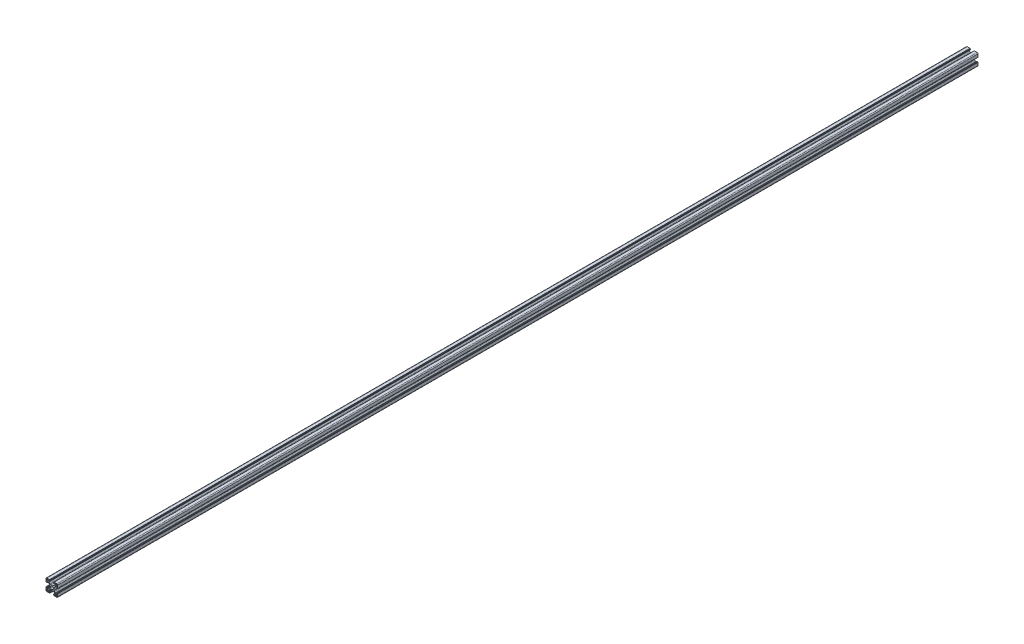
from build123d import *

# Parameters (mm, degrees)
EXTRUDE_1_DEPTH = 1570


with BuildPart() as part:
    # Эскиз1 → Бобышка-Вытянуть1 (new body)
    with BuildSketch(Plane.XY):
        with BuildLine():
            Line((0.259458272, 4.035699369), (2.158238941, 4.035699369))
            ThreePointArc((2.158238941, 4.035699369), (2.923605806, 4.187940304), (3.572452504, 4.621485807))
            Line((3.572452504, 4.621485807), (4.873671834, 5.922705138))
            ThreePointArc((4.873671834, 5.922705138), (5.307217337, 6.571551836), (5.459458272, 7.3369187))
            Line((5.459458272, 7.3369187), (5.459458272, 8.235699369))
            ThreePointArc((5.459458272, 8.235699369), (5.313011663, 8.58925276), (4.959458272, 8.735699369))
            Line((4.959458272, 8.735699369), (4.856565053, 8.735699369))
            ThreePointArc((4.856565053, 8.735699369), (4.665223337, 8.697639136), (4.503011663, 8.58925276))
            Line((4.503011663, 8.58925276), (4.022681577, 8.108922674))
            ThreePointArc((4.022681577, 8.108922674), (3.94157574, 8.054729486), (3.845904882, 8.035699369))
            Line((3.845904882, 8.035699369), (3.559458272, 8.035699369))
            ThreePointArc((3.559458272, 8.035699369), (3.382681577, 8.108922674), (3.309458272, 8.285699369))
            Line((3.309458272, 8.285699369), (3.309458272, 9.43477019))
            ThreePointArc((3.309458272, 9.43477019), (3.353392255, 9.540836207), (3.459458272, 9.58477019))
            Line((3.459458272, 9.58477019), (3.959458272, 9.58477019))
            Line((3.959458272, 9.58477019), (3.959458272, 9.885699369))
            ThreePointArc((3.959458272, 9.885699369), (4.003392255, 9.991765387), (4.109458272, 10.035699369))
            Line((4.109458272, 10.035699369), (8.759458272, 10.035699369))
            ThreePointArc((8.759458272, 10.035699369), (9.820118444, 9.596359541), (10.259458272, 8.535699369))
            Line((10.259458272, 8.535699369), (10.259458272, 3.885699369))
            ThreePointArc((10.259458272, 3.885699369), (10.215524289, 3.779633352), (10.109458272, 3.735699369))
            Line((10.109458272, 3.735699369), (9.808529093, 3.735699369))
            Line((9.808529093, 3.735699369), (9.808529093, 3.235699369))
            ThreePointArc((9.808529093, 3.235699369), (9.76459511, 3.129633352), (9.658529093, 3.085699369))
            Line((9.658529093, 3.085699369), (8.509458272, 3.085699369))
            ThreePointArc((8.509458272, 3.085699369), (8.332681577, 3.158922674), (8.259458272, 3.335699369))
            Line((8.259458272, 3.335699369), (8.259458272, 3.622145979))
            ThreePointArc((8.259458272, 3.622145979), (8.278488389, 3.717816837), (8.332681577, 3.798922674))
            Line((8.332681577, 3.798922674), (8.813011663, 4.27925276))
            ThreePointArc((8.813011663, 4.27925276), (8.921398038, 4.441464434), (8.959458272, 4.632806151))
            Line((8.959458272, 4.632806151), (8.959458272, 4.735699369))
            ThreePointArc((8.959458272, 4.735699369), (8.813011663, 5.08925276), (8.459458272, 5.235699369))
            Line((8.459458272, 5.235699369), (7.560677603, 5.235699369))
            ThreePointArc((7.560677603, 5.235699369), (6.795310738, 5.083458434), (6.146464041, 4.649912932))
            Line((6.146464041, 4.649912932), (4.84524471, 3.348693601))
            ThreePointArc((4.84524471, 3.348693601), (4.411699207, 2.699846903), (4.259458272, 1.934480039))
            Line((4.259458272, 1.934480039), (4.259458272, 0.035699369))
            Line((4.259458272, 0.035699369), (4.259458272, -1.8630813))
            ThreePointArc((4.259458272, -1.8630813), (4.411699207, -2.628448164), (4.84524471, -3.277294862))
            Line((4.84524471, -3.277294862), (6.146464041, -4.578514193))
            ThreePointArc((6.146464041, -4.578514193), (6.795310738, -5.012059696), (7.560677603, -5.164300631))
            Line((7.560677603, -5.164300631), (8.459458272, -5.164300631))
            ThreePointArc((8.459458272, -5.164300631), (8.813011663, -5.017854021), (8.959458272, -4.664300631))
            Line((8.959458272, -4.664300631), (8.959458272, -4.561407412))
            ThreePointArc((8.959458272, -4.561407412), (8.921398038, -4.370065696), (8.813011663, -4.207854021))
            Line((8.813011663, -4.207854021), (8.332681577, -3.727523935))
            ThreePointArc((8.332681577, -3.727523935), (8.278488389, -3.646418098), (8.259458272, -3.55074724))
            Line((8.259458272, -3.55074724), (8.259458272, -3.264300631))
            ThreePointArc((8.259458272, -3.264300631), (8.332681577, -3.087523935), (8.509458272, -3.014300631))
            Line((8.509458272, -3.014300631), (9.658529093, -3.014300631))
            ThreePointArc((9.658529093, -3.014300631), (9.76459511, -3.058234613), (9.808529093, -3.164300631))
            Line((9.808529093, -3.164300631), (9.808529093, -3.664300631))
            Line((9.808529093, -3.664300631), (10.109458272, -3.664300631))
            ThreePointArc((10.109458272, -3.664300631), (10.215524289, -3.708234613), (10.259458272, -3.814300631))
            Line((10.259458272, -3.814300631), (10.259458272, -8.464300631))
            ThreePointArc((10.259458272, -8.464300631), (9.820118444, -9.524960802), (8.759458272, -9.964300631))
            Line((8.759458272, -9.964300631), (4.109458272, -9.964300631))
            ThreePointArc((4.109458272, -9.964300631), (4.003392255, -9.920366648), (3.959458272, -9.814300631))
            Line((3.959458272, -9.814300631), (3.959458272, -9.513371451))
            Line((3.959458272, -9.513371451), (3.459458272, -9.513371451))
            ThreePointArc((3.459458272, -9.513371451), (3.353392255, -9.469437468), (3.309458272, -9.363371451))
            Line((3.309458272, -9.363371451), (3.309458272, -8.214300631))
            ThreePointArc((3.309458272, -8.214300631), (3.382681577, -8.037523935), (3.559458272, -7.964300631))
            Line((3.559458272, -7.964300631), (3.845904882, -7.964300631))
            ThreePointArc((3.845904882, -7.964300631), (3.94157574, -7.983330747), (4.022681577, -8.037523935))
            Line((4.022681577, -8.037523935), (4.503011663, -8.517854021))
            ThreePointArc((4.503011663, -8.517854021), (4.665223337, -8.626240397), (4.856565053, -8.664300631))
            Line((4.856565053, -8.664300631), (4.959458272, -8.664300631))
            ThreePointArc((4.959458272, -8.664300631), (5.313011663, -8.517854021), (5.459458272, -8.164300631))
            Line((5.459458272, -8.164300631), (5.459458272, -7.265519961))
            ThreePointArc((5.459458272, -7.265519961), (5.307217337, -6.500153097), (4.873671834, -5.851306399))
            Line((4.873671834, -5.851306399), (3.572452504, -4.550087068))
            ThreePointArc((3.572452504, -4.550087068), (2.923605806, -4.116541566), (2.158238941, -3.964300631))
            Line((2.158238941, -3.964300631), (0.259458272, -3.964300631))
            Line((0.259458272, -3.964300631), (-1.639322397, -3.964300631))
            ThreePointArc((-1.639322397, -3.964300631), (-2.404689262, -4.116541566), (-3.053535959, -4.550087068))
            Line((-3.053535959, -4.550087068), (-4.35475529, -5.851306399))
            ThreePointArc((-4.35475529, -5.851306399), (-4.788300793, -6.500153097), (-4.940541728, -7.265519961))
            Line((-4.940541728, -7.265519961), (-4.940541728, -8.164300631))
            ThreePointArc((-4.940541728, -8.164300631), (-4.794095118, -8.517854021), (-4.440541728, -8.664300631))
            Line((-4.440541728, -8.664300631), (-4.337648509, -8.664300631))
            ThreePointArc((-4.337648509, -8.664300631), (-4.146306793, -8.626240397), (-3.984095118, -8.517854021))
            Line((-3.984095118, -8.517854021), (-3.503765033, -8.037523935))
            ThreePointArc((-3.503765033, -8.037523935), (-3.422659195, -7.983330747), (-3.326988337, -7.964300631))
            Line((-3.326988337, -7.964300631), (-3.040541728, -7.964300631))
            ThreePointArc((-3.040541728, -7.964300631), (-2.863765033, -8.037523935), (-2.790541728, -8.214300631))
            Line((-2.790541728, -8.214300631), (-2.790541728, -9.363371451))
            ThreePointArc((-2.790541728, -9.363371451), (-2.834475711, -9.469437468), (-2.940541728, -9.513371451))
            Line((-2.940541728, -9.513371451), (-3.440541728, -9.513371451))
            Line((-3.440541728, -9.513371451), (-3.440541728, -9.814300631))
            ThreePointArc((-3.440541728, -9.814300631), (-3.484475711, -9.920366648), (-3.590541728, -9.964300631))
            Line((-3.590541728, -9.964300631), (-8.240541728, -9.964300631))
            ThreePointArc((-8.240541728, -9.964300631), (-9.3012019, -9.524960802), (-9.740541728, -8.464300631))
            Line((-9.740541728, -8.464300631), (-9.740541728, -3.814300631))
            ThreePointArc((-9.740541728, -3.814300631), (-9.696607745, -3.708234613), (-9.590541728, -3.664300631))
            Line((-9.590541728, -3.664300631), (-9.289612548, -3.664300631))
            Line((-9.289612548, -3.664300631), (-9.289612548, -3.164300631))
            ThreePointArc((-9.289612548, -3.164300631), (-9.245678566, -3.058234613), (-9.139612548, -3.014300631))
            Line((-9.139612548, -3.014300631), (-7.990541728, -3.014300631))
            ThreePointArc((-7.990541728, -3.014300631), (-7.813765033, -3.087523935), (-7.740541728, -3.264300631))
            Line((-7.740541728, -3.264300631), (-7.740541728, -3.55074724))
            ThreePointArc((-7.740541728, -3.55074724), (-7.759571845, -3.646418098), (-7.813765033, -3.727523935))
            Line((-7.813765033, -3.727523935), (-8.294095118, -4.207854021))
            ThreePointArc((-8.294095118, -4.207854021), (-8.402481494, -4.370065696), (-8.440541728, -4.561407412))
            Line((-8.440541728, -4.561407412), (-8.440541728, -4.664300631))
            ThreePointArc((-8.440541728, -4.664300631), (-8.294095118, -5.017854021), (-7.940541728, -5.164300631))
            Line((-7.940541728, -5.164300631), (-7.041761059, -5.164300631))
            ThreePointArc((-7.041761059, -5.164300631), (-6.276394194, -5.012059696), (-5.627547496, -4.578514193))
            Line((-5.627547496, -4.578514193), (-4.326328166, -3.277294862))
            ThreePointArc((-4.326328166, -3.277294862), (-3.892782663, -2.628448164), (-3.740541728, -1.8630813))
            Line((-3.740541728, -1.8630813), (-3.740541728, 0.035699369))
            Line((-3.740541728, 0.035699369), (-3.740541728, 1.934480039))
            ThreePointArc((-3.740541728, 1.934480039), (-3.892782663, 2.699846903), (-4.326328166, 3.348693601))
            Line((-4.326328166, 3.348693601), (-5.627547496, 4.649912932))
            ThreePointArc((-5.627547496, 4.649912932), (-6.276394194, 5.083458434), (-7.041761059, 5.235699369))
            Line((-7.041761059, 5.235699369), (-7.940541728, 5.235699369))
            ThreePointArc((-7.940541728, 5.235699369), (-8.294095118, 5.08925276), (-8.440541728, 4.735699369))
            Line((-8.440541728, 4.735699369), (-8.440541728, 4.632806151))
            ThreePointArc((-8.440541728, 4.632806151), (-8.402481494, 4.441464434), (-8.294095118, 4.27925276))
            Line((-8.294095118, 4.27925276), (-7.813765033, 3.798922674))
            ThreePointArc((-7.813765033, 3.798922674), (-7.759571845, 3.717816837), (-7.740541728, 3.622145979))
            Line((-7.740541728, 3.622145979), (-7.740541728, 3.335699369))
            ThreePointArc((-7.740541728, 3.335699369), (-7.813765033, 3.158922674), (-7.990541728, 3.085699369))
            Line((-7.990541728, 3.085699369), (-9.139612548, 3.085699369))
            ThreePointArc((-9.139612548, 3.085699369), (-9.245678566, 3.129633352), (-9.289612548, 3.235699369))
            Line((-9.289612548, 3.235699369), (-9.289612548, 3.735699369))
            Line((-9.289612548, 3.735699369), (-9.590541728, 3.735699369))
            ThreePointArc((-9.590541728, 3.735699369), (-9.696607745, 3.779633352), (-9.740541728, 3.885699369))
            Line((-9.740541728, 3.885699369), (-9.740541728, 8.535699369))
            ThreePointArc((-9.740541728, 8.535699369), (-9.3012019, 9.596359541), (-8.240541728, 10.035699369))
            Line((-8.240541728, 10.035699369), (-3.590541728, 10.035699369))
            ThreePointArc((-3.590541728, 10.035699369), (-3.484475711, 9.991765387), (-3.440541728, 9.885699369))
            Line((-3.440541728, 9.885699369), (-3.440541728, 9.58477019))
            Line((-3.440541728, 9.58477019), (-2.940541728, 9.58477019))
            ThreePointArc((-2.940541728, 9.58477019), (-2.834475711, 9.540836207), (-2.790541728, 9.43477019))
            Line((-2.790541728, 9.43477019), (-2.790541728, 8.285699369))
            ThreePointArc((-2.790541728, 8.285699369), (-2.863765033, 8.108922674), (-3.040541728, 8.035699369))
            Line((-3.040541728, 8.035699369), (-3.326988337, 8.035699369))
            ThreePointArc((-3.326988337, 8.035699369), (-3.422659195, 8.054729486), (-3.503765033, 8.108922674))
            Line((-3.503765033, 8.108922674), (-3.984095118, 8.58925276))
            ThreePointArc((-3.984095118, 8.58925276), (-4.146306793, 8.697639136), (-4.337648509, 8.735699369))
            Line((-4.337648509, 8.735699369), (-4.440541728, 8.735699369))
            ThreePointArc((-4.440541728, 8.735699369), (-4.794095118, 8.58925276), (-4.940541728, 8.235699369))
            Line((-4.940541728, 8.235699369), (-4.940541728, 7.3369187))
            ThreePointArc((-4.940541728, 7.3369187), (-4.788300793, 6.571551836), (-4.35475529, 5.922705138))
            Line((-4.35475529, 5.922705138), (-3.053535959, 4.621485807))
            ThreePointArc((-3.053535959, 4.621485807), (-2.404689262, 4.187940304), (-1.639322397, 4.035699369))
            Line((-1.639322397, 4.035699369), (0.259458272, 4.035699369))
        make_face()
        with BuildLine():
            Line((7.159458272, 6.135699369), (8.559458272, 6.135699369))
            ThreePointArc((8.559458272, 6.135699369), (9.125143697, 6.370013944), (9.359458272, 6.935699369))
            Line((9.359458272, 6.935699369), (9.359458272, 8.335699369))
            ThreePointArc((9.359458272, 8.335699369), (9.125143697, 8.901384794), (8.559458272, 9.135699369))
            Line((8.559458272, 9.135699369), (7.159458272, 9.135699369))
            ThreePointArc((7.159458272, 9.135699369), (6.593772847, 8.901384794), (6.359458272, 8.335699369))
            Line((6.359458272, 8.335699369), (6.359458272, 6.935699369))
            ThreePointArc((6.359458272, 6.935699369), (6.593772847, 6.370013944), (7.159458272, 6.135699369))
        make_face(mode=Mode.SUBTRACT)
        with BuildLine():
            Line((6.359458272, -6.864300631), (6.359458272, -8.264300631))
            ThreePointArc((6.359458272, -8.264300631), (6.593772847, -8.829986056), (7.159458272, -9.064300631))
            Line((7.159458272, -9.064300631), (8.559458272, -9.064300631))
            ThreePointArc((8.559458272, -9.064300631), (9.125143697, -8.829986056), (9.359458272, -8.264300631))
            Line((9.359458272, -8.264300631), (9.359458272, -6.864300631))
            ThreePointArc((9.359458272, -6.864300631), (9.125143697, -6.298615206), (8.559458272, -6.064300631))
            Line((8.559458272, -6.064300631), (7.159458272, -6.064300631))
            ThreePointArc((7.159458272, -6.064300631), (6.593772847, -6.298615206), (6.359458272, -6.864300631))
        make_face(mode=Mode.SUBTRACT)
        with BuildLine():
            Line((-6.640541728, -6.064300631), (-8.040541728, -6.064300631))
            ThreePointArc((-8.040541728, -6.064300631), (-8.606227153, -6.298615206), (-8.840541728, -6.864300631))
            Line((-8.840541728, -6.864300631), (-8.840541728, -8.264300631))
            ThreePointArc((-8.840541728, -8.264300631), (-8.606227153, -8.829986056), (-8.040541728, -9.064300631))
            Line((-8.040541728, -9.064300631), (-6.640541728, -9.064300631))
            ThreePointArc((-6.640541728, -9.064300631), (-6.074856303, -8.829986056), (-5.840541728, -8.264300631))
            Line((-5.840541728, -8.264300631), (-5.840541728, -6.864300631))
            ThreePointArc((-5.840541728, -6.864300631), (-6.074856303, -6.298615206), (-6.640541728, -6.064300631))
        make_face(mode=Mode.SUBTRACT)
        with BuildLine():
            Line((-5.840541728, 6.935699369), (-5.840541728, 8.335699369))
            ThreePointArc((-5.840541728, 8.335699369), (-6.074856303, 8.901384794), (-6.640541728, 9.135699369))
            Line((-6.640541728, 9.135699369), (-8.040541728, 9.135699369))
            ThreePointArc((-8.040541728, 9.135699369), (-8.606227153, 8.901384794), (-8.840541728, 8.335699369))
            Line((-8.840541728, 8.335699369), (-8.840541728, 6.935699369))
            ThreePointArc((-8.840541728, 6.935699369), (-8.606227153, 6.370013944), (-8.040541728, 6.135699369))
            Line((-8.040541728, 6.135699369), (-6.640541728, 6.135699369))
            ThreePointArc((-6.640541728, 6.135699369), (-6.074856303, 6.370013944), (-5.840541728, 6.935699369))
        make_face(mode=Mode.SUBTRACT)
        with BuildLine():
            ThreePointArc((2.759458272, 0.035699369), (2.027225225, 1.803466322), (0.259458272, 2.535699369))
            ThreePointArc((0.259458272, 2.535699369), (-1.508308681, 1.803466322), (-2.240541728, 0.035699369))
            ThreePointArc((-2.240541728, 0.035699369), (-1.508308681, -1.732067584), (0.259458272, -2.464300631))
            ThreePointArc((0.259458272, -2.464300631), (2.027225225, -1.732067584), (2.759458272, 0.035699369))
        make_face(mode=Mode.SUBTRACT)
    extrude(amount=EXTRUDE_1_DEPTH)


solid = part.part
